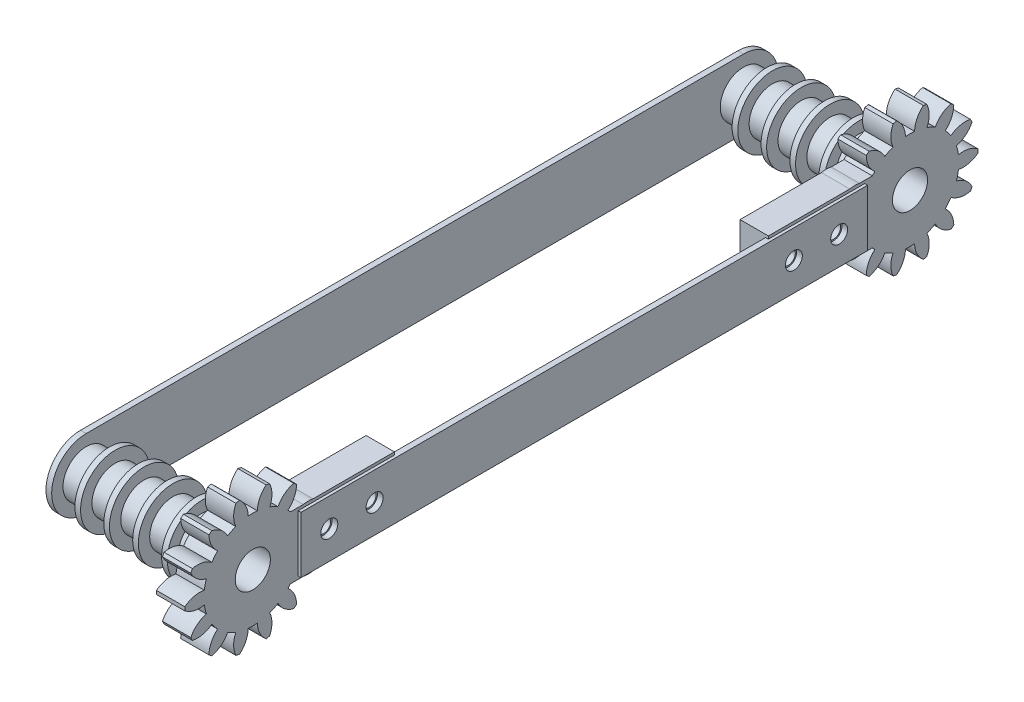
from build123d import *

# Parameters (mm, degrees)
BASPROSKE_W              = 5
BASPROSKE_H              = 12
TOOTHCUT_DEPTH           = 18.691806013
TEETHCUTS_COUNT          = 14
TEETHCUTS_ANGLE          = 334.285714286
BORSKE_R                 = 3.1
BORE_DEPTH               = 50.0000508
SKETCH_2_W               = 20
SKETCH_2_H               = 11
EXTRUDE_1_DEPTH          = 5
SKETCH_3_W               = 17
SKETCH_3_H               = 10
CUT_EXTRUDE_1_DEPTH      = 0.5
SKETCH_5_W               = 10
SKETCH_5_H               = 10
SKETCH_5_W_2             = 8
SKETCH_5_H_2             = 8
EXTRUDE_2_DEPTH          = 100
CUT_EXTRUDE_2_DEPTH      = 110.602402747
CUT_EXTRUDE_2_DEPTH_BACK = 110.602402747
SKETCH_4_R               = 1.25
SKETCH_7_R               = 4.1
SKETCH_7_R_2             = 3.1
EXTRUDE_3_DEPTH          = 4
SKETCH_9_R               = 6.1
SKETCH_9_R_2             = 3.1
EXTRUDE_4_DEPTH          = 1
SKETCH_6_R               = 1.5
CUT_EXTRUDE_3_DEPTH      = 129.928029101
PATTERN_LINEAR_1_COUNT   = 5
PATTERN_LINEAR_1_PITCH   = 5.1
PATTERN_LINEAR_2_COUNT   = 4
PATTERN_LINEAR_2_PITCH   = 5.1
SKETCH_10_W              = 9
SKETCH_10_H              = 10
CUT_EXTRUDE_4_DEPTH      = 100
SKETCH_12_R              = 3.1
EXTRUDE_5_DEPTH          = 1


with BuildPart() as part:
    # BasProSke → Base-Revolve (revolve)
    with BuildSketch(Plane(origin=(0, 0, 0), x_dir=(1, 0, 0), z_dir=(0, 1, 0)), mode=Mode.PRIVATE) as base_revolve_sk:
        with Locations((2.5, 6)):
            Rectangle(BASPROSKE_W, BASPROSKE_H)
    revolve(base_revolve_sk.sketch.rotate(Axis((-10, 0, 0), (1, 0, 0)), 180), axis=Axis((-10, 0, 0), (1, 0, 0)))

    # TooCutSke → ToothCut (cut, through all)
    with BuildSketch(Plane(origin=(0, 0, 0), x_dir=(0, 0, -1), z_dir=(1, 0, 0))):
        with BuildLine():
            ThreePointArc((0.804845511, 8.586361261), (0, 8.624), (-0.804845511, 8.586361261))
            ThreePointArc((-0.804845511, 8.586361261), (-1.237812142, 10.362618414), (-2.384428228, 11.78663426))
            ThreePointArc((-2.384428228, 11.78663426), (0, 12.0254), (2.384428228, 11.78663426))
            ThreePointArc((2.384428228, 11.78663426), (1.237812142, 10.362618414), (0.804845511, 8.586361261))
        make_face()
    toothcut = extrude(amount=TOOTHCUT_DEPTH, mode=Mode.SUBTRACT)

    # TeethCuts: ToothCut ×14 about axis
    teethcuts_axis = Axis((-10, 0, 0), (1, 0, 0))
    for i in range(1, TEETHCUTS_COUNT):
        add(toothcut.rotate(teethcuts_axis, i * TEETHCUTS_ANGLE / (TEETHCUTS_COUNT - 1)), mode=Mode.SUBTRACT)

    # BorSke → Bore (cut, symmetric)
    with BuildSketch(Plane(origin=(0, 0, 0), x_dir=(0, 0, -1), z_dir=(1, 0, 0))):
        with Locations(Location((0, 0, 0), (0, 0, 180))):
            Circle(BORSKE_R)
    extrude(amount=BORE_DEPTH, both=True, mode=Mode.SUBTRACT)

    # ｽｹｯﾁ2 → ﾎﾞｽ - 押し出し1 (add)
    with BuildSketch(Plane(origin=(5, 0, 0), x_dir=(0, 0, -1), z_dir=(1, 0, 0))):
        with Locations((15, 0)):
            Rectangle(SKETCH_2_W, SKETCH_2_H)
    extrude(amount=-EXTRUDE_1_DEPTH)

    # ｽｹｯﾁ3 → ｶｯﾄ - 押し出し1 (cut)
    with BuildSketch(Plane(origin=(5, 0, 0), x_dir=(0, 0, -1), z_dir=(1, 0, 0))):
        with Locations((16.5, 0)):
            Rectangle(SKETCH_3_W, SKETCH_3_H)
    extrude(amount=-CUT_EXTRUDE_1_DEPTH, mode=Mode.SUBTRACT)

    # ｽｹｯﾁ4 → ｶｯﾄ - 押し出し2 (cut, two sides: drawn at the far end of the back side and taken through both)
    with BuildSketch(Plane.ZY.offset(-CUT_EXTRUDE_2_DEPTH_BACK)):
        with Locations(Location((-21, 0, 0), (0, 0, 180))):
            Circle(SKETCH_4_R)
        with Locations(Location((-13, 0, 0), (0, 0, 180))):
            Circle(SKETCH_4_R)
    extrude(amount=CUT_EXTRUDE_2_DEPTH + CUT_EXTRUDE_2_DEPTH_BACK, mode=Mode.SUBTRACT)


with BuildPart() as body_2:
    # ｽｹｯﾁ5 → ﾎﾞｽ - 押し出し2 (new body)
    with BuildSketch(Plane(origin=(0, 0, -8), x_dir=(-1, 0, 0), z_dir=(0, 0, -1))):
        with Locations((-9.5, 0)):
            Rectangle(SKETCH_5_W, SKETCH_5_H)
        with Locations((-9.5, 0)):
            Rectangle(SKETCH_5_W_2, SKETCH_5_H_2, mode=Mode.SUBTRACT)
    extrude(amount=EXTRUDE_2_DEPTH)

    # ｽｹｯﾁ6 → ｶｯﾄ - 押し出し3 (cut, through all)
    with BuildSketch(Plane.ZY.offset(-4.5)):
        with Locations((-103, 0)):
            Circle(SKETCH_6_R)
        with Locations((-95, 0)):
            Circle(SKETCH_6_R)
        with Locations((-21, 0)):
            Circle(SKETCH_6_R)
        with Locations((-13, 0)):
            Circle(SKETCH_6_R)
    extrude(amount=-CUT_EXTRUDE_3_DEPTH, mode=Mode.SUBTRACT)

    # ｽｹｯﾁ10 → ｶｯﾄ - 押し出し4 (cut)
    with BuildSketch(Plane.XY.offset(-8)):
        with Locations((10, 0)):
            Rectangle(SKETCH_10_W, SKETCH_10_H)
    extrude(amount=-CUT_EXTRUDE_4_DEPTH, mode=Mode.SUBTRACT)


with BuildPart() as body_3:
    # ｽｹｯﾁ7 → ﾎﾞｽ - 押し出し3 (new body)
    with BuildSketch(Plane.ZY):
        Circle(SKETCH_7_R)
        Circle(SKETCH_7_R_2, mode=Mode.SUBTRACT)
    extrude(amount=EXTRUDE_3_DEPTH)


with BuildPart() as body_4:
    # ｽｹｯﾁ9 → ﾎﾞｽ - 押し出し4 (new body)
    with BuildSketch(Plane.ZY.offset(4)):
        Circle(SKETCH_9_R)
        Circle(SKETCH_9_R_2, mode=Mode.SUBTRACT)
    extrude(amount=EXTRUDE_4_DEPTH)


with BuildPart() as body_5:
    # ﾐﾗｰ2: mirrored copy
    add(part.part.mirror(Plane(origin=(0, 0, -58), x_dir=(1, 0, 0), z_dir=(0, 0, -1))))


with BuildPart() as body_6:
    # Mirror 2 2: mirrored copy
    add(body_3.part.mirror(Plane(origin=(0, 0, -58), x_dir=(1, 0, 0), z_dir=(0, 0, -1))))


with BuildPart() as body_7:
    # Mirror 2 3: mirrored copy
    add(body_4.part.mirror(Plane(origin=(0, 0, -58), x_dir=(1, 0, 0), z_dir=(0, 0, -1))))


with BuildPart() as pattern_linear_1_1:
    # 直線ﾊﾟﾀｰﾝ1: pattern copy
    add(body_6.part.moved(Location(Vector(-1, 0, 0) * (1 * PATTERN_LINEAR_1_PITCH))))


with BuildPart() as pattern_linear_1_2:
    # 直線ﾊﾟﾀｰﾝ1: pattern copy
    add(body_6.part.moved(Location(Vector(-1, 0, 0) * (2 * PATTERN_LINEAR_1_PITCH))))


with BuildPart() as pattern_linear_1_3:
    # 直線ﾊﾟﾀｰﾝ1: pattern copy
    add(body_6.part.moved(Location(Vector(-1, 0, 0) * (3 * PATTERN_LINEAR_1_PITCH))))


with BuildPart() as pattern_linear_1_4:
    # 直線ﾊﾟﾀｰﾝ1: pattern copy
    add(body_6.part.moved(Location(Vector(-1, 0, 0) * (4 * PATTERN_LINEAR_1_PITCH))))


with BuildPart() as pattern_linear_1_5:
    # 直線ﾊﾟﾀｰﾝ1: pattern copy
    add(body_3.part.moved(Location(Vector(-1, 0, 0) * (1 * PATTERN_LINEAR_1_PITCH))))


with BuildPart() as pattern_linear_1_6:
    # 直線ﾊﾟﾀｰﾝ1: pattern copy
    add(body_3.part.moved(Location(Vector(-1, 0, 0) * (2 * PATTERN_LINEAR_1_PITCH))))


with BuildPart() as pattern_linear_1_7:
    # 直線ﾊﾟﾀｰﾝ1: pattern copy
    add(body_3.part.moved(Location(Vector(-1, 0, 0) * (3 * PATTERN_LINEAR_1_PITCH))))


with BuildPart() as pattern_linear_1_8:
    # 直線ﾊﾟﾀｰﾝ1: pattern copy
    add(body_3.part.moved(Location(Vector(-1, 0, 0) * (4 * PATTERN_LINEAR_1_PITCH))))


with BuildPart() as pattern_linear_2_1:
    # 直線ﾊﾟﾀｰﾝ2: pattern copy
    add(body_4.part.moved(Location(Vector(-1, 0, 0) * (1 * PATTERN_LINEAR_2_PITCH))))


with BuildPart() as pattern_linear_2_2:
    # 直線ﾊﾟﾀｰﾝ2: pattern copy
    add(body_4.part.moved(Location(Vector(-1, 0, 0) * (2 * PATTERN_LINEAR_2_PITCH))))


with BuildPart() as pattern_linear_2_3:
    # 直線ﾊﾟﾀｰﾝ2: pattern copy
    add(body_4.part.moved(Location(Vector(-1, 0, 0) * (3 * PATTERN_LINEAR_2_PITCH))))


with BuildPart() as pattern_linear_2_4:
    # 直線ﾊﾟﾀｰﾝ2: pattern copy
    add(body_7.part.moved(Location(Vector(-1, 0, 0) * (1 * PATTERN_LINEAR_2_PITCH))))


with BuildPart() as pattern_linear_2_5:
    # 直線ﾊﾟﾀｰﾝ2: pattern copy
    add(body_7.part.moved(Location(Vector(-1, 0, 0) * (2 * PATTERN_LINEAR_2_PITCH))))


with BuildPart() as pattern_linear_2_6:
    # 直線ﾊﾟﾀｰﾝ2: pattern copy
    add(body_7.part.moved(Location(Vector(-1, 0, 0) * (3 * PATTERN_LINEAR_2_PITCH))))


with BuildPart() as body_22:
    # ｽｹｯﾁ12 → ﾎﾞｽ - 押し出し5 (new body)
    with BuildSketch(Plane.ZY.offset(24.4)):
        with BuildLine():
            Line((0, -6.1), (-116, -6.1))
            ThreePointArc((-116, -6.1), (-122.1, 0), (-116, 6.1))
            Line((-116, 6.1), (0, 6.1))
            ThreePointArc((0, 6.1), (6.1, 0), (0, -6.1))
        make_face()
        Circle(SKETCH_12_R, mode=Mode.SUBTRACT)
        with Locations((-116, 0)):
            Circle(SKETCH_12_R, mode=Mode.SUBTRACT)
    extrude(amount=EXTRUDE_5_DEPTH)


solid = Compound([part.part, body_2.part, body_3.part, body_4.part, body_5.part, body_6.part, body_7.part, pattern_linear_1_1.part, pattern_linear_1_2.part, pattern_linear_1_3.part, pattern_linear_1_4.part, pattern_linear_1_5.part, pattern_linear_1_6.part, pattern_linear_1_7.part, pattern_linear_1_8.part, pattern_linear_2_1.part, pattern_linear_2_2.part, pattern_linear_2_3.part, pattern_linear_2_4.part, pattern_linear_2_5.part, pattern_linear_2_6.part, body_22.part])
